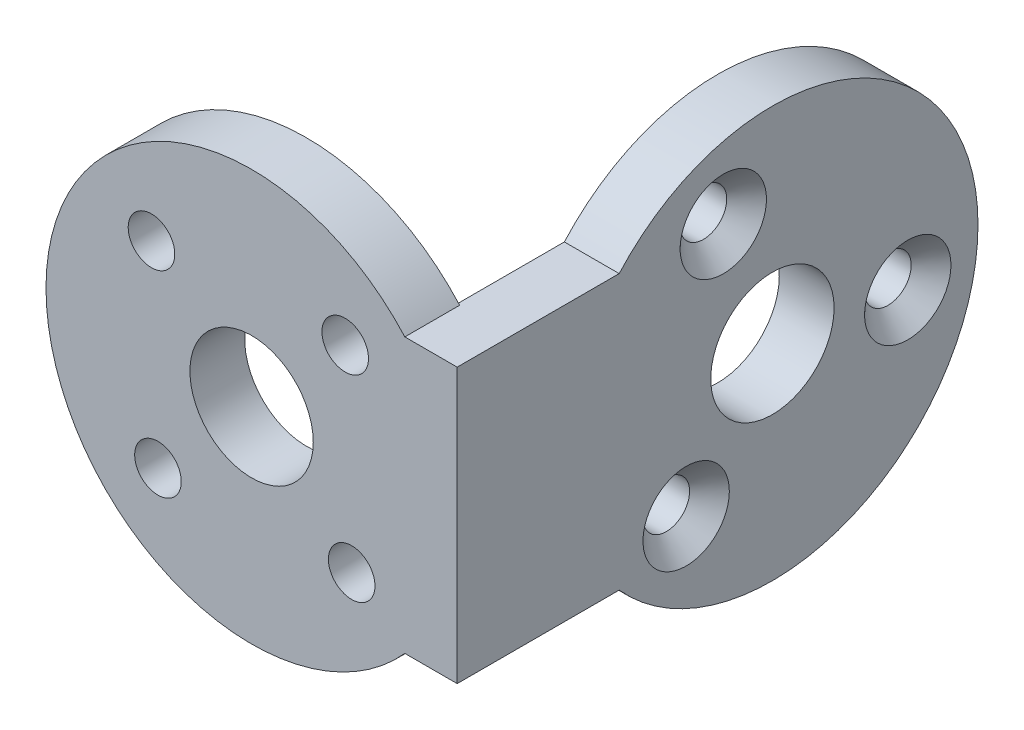
from build123d import *

# Parameters (mm, degrees)
ESQUISSE1_R                                    = 4.5
ESQUISSE1_R_2                                  = 1.5
BOSS_EXTRU_1_DEPTH                             = 4
ESQUISSE3_R                                    = 4.5
ESQUISSE3_R_2                                  = 1.500083245
BOSS_EXTRU_2_DEPTH                             = 4
FRAISAGE_POUR_VIS_T_TE_FRAIS_E_M31_D           = 3.4
FRAISAGE_POUR_VIS_T_TE_FRAIS_E_M31_CSINK_D     = 6.3
FRAISAGE_POUR_VIS_T_TE_FRAIS_E_M31_CSINK_ANGLE = 90
FRAISAGE_POUR_VIS_T_TE_FRAIS_E_M32_D           = 3.4
FRAISAGE_POUR_VIS_T_TE_FRAIS_E_M32_CSINK_D     = 6.3
FRAISAGE_POUR_VIS_T_TE_FRAIS_E_M32_CSINK_ANGLE = 90


with BuildPart() as part:
    # Esquisse1 → Boss.-Extru.1 (new body)
    with BuildSketch(Plane.XY):
        with BuildLine():
            Line((11.180339887, 10), (15, 10))
            Line((15, 10), (15, -10))
            Line((15, -10), (11.180339887, -10))
            ThreePointArc((11.180339887, -10), (-15, 0), (11.180339887, 10))
        make_face()
        Circle(ESQUISSE1_R, mode=Mode.SUBTRACT)
        with Locations((-7.303420571, 6.830816054)):
            Circle(ESQUISSE1_R_2, mode=Mode.SUBTRACT)
        with Locations((6.830816054, 7.303420571)):
            Circle(ESQUISSE1_R_2, mode=Mode.SUBTRACT)
        with Locations((7.303420571, -6.830816054)):
            Circle(ESQUISSE1_R_2, mode=Mode.SUBTRACT)
        with Locations((-6.830816054, -7.303420571)):
            Circle(ESQUISSE1_R_2, mode=Mode.SUBTRACT)
    extrude(amount=BOSS_EXTRU_1_DEPTH)

    # Esquisse3 → Boss.-Extru.2 (add)
    with BuildSketch(Plane(origin=(15, 0, 0), x_dir=(0, 0, -1), z_dir=(1, 0, 0))):
        with BuildLine():
            Line((0, 10), (7.819660113, 10))
            ThreePointArc((7.819660113, 10), (34, 0), (7.819660113, -10))
            Line((7.819660113, -10), (0, -10))
            Line((0, -10), (0, 10))
        make_face()
        with Locations((19, 0)):
            Circle(ESQUISSE3_R, mode=Mode.SUBTRACT)
        with Locations((15.416309522, 9.335800049)):
            Circle(ESQUISSE3_R_2, mode=Mode.SUBTRACT)
        with Locations((28.876885246, -1.564333031)):
            Circle(ESQUISSE3_R_2, mode=Mode.SUBTRACT)
        with Locations((12.706805232, -7.771467018)):
            Circle(ESQUISSE3_R_2, mode=Mode.SUBTRACT)
    extrude(amount=-BOSS_EXTRU_2_DEPTH)

    # Fraisage pour vis à tête fraisée M31 (through all)
    with Locations(Plane(origin=(0, 0, 0), x_dir=(-1, 0, 0), z_dir=(0, 0, -1))):
        with Locations((-6.830816054, 7.303420571), (7.303420571, 6.830816054), (6.830816054, -7.303420571), (-7.303420571, -6.830816054)):
            CounterSinkHole(FRAISAGE_POUR_VIS_T_TE_FRAIS_E_M31_D / 2, FRAISAGE_POUR_VIS_T_TE_FRAIS_E_M31_CSINK_D / 2, counter_sink_angle=FRAISAGE_POUR_VIS_T_TE_FRAIS_E_M31_CSINK_ANGLE)

    # Fraisage pour vis à tête fraisée M32 (through all)
    with Locations(Plane(origin=(15, 0, 0), x_dir=(0, 0, -1), z_dir=(1, 0, 0))):
        with Locations((15.416309522, 9.335800049), (28.876885246, -1.564333031), (12.706805232, -7.771467018)):
            CounterSinkHole(FRAISAGE_POUR_VIS_T_TE_FRAIS_E_M32_D / 2, FRAISAGE_POUR_VIS_T_TE_FRAIS_E_M32_CSINK_D / 2, counter_sink_angle=FRAISAGE_POUR_VIS_T_TE_FRAIS_E_M32_CSINK_ANGLE)


solid = part.part
